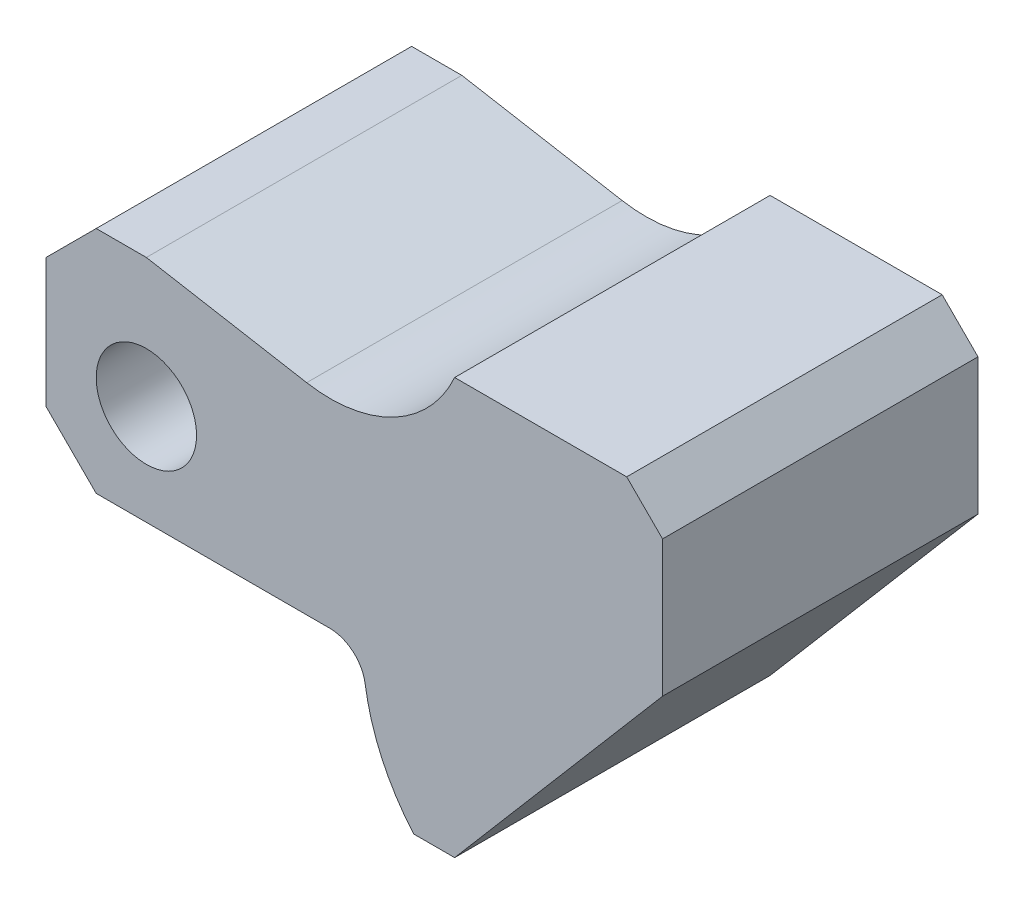
from build123d import *

# Parameters (mm, degrees)
BOSS_EXTRUDE1_DEPTH = 44
SKETCH5_R           = 7
CUT_EXTRUDE1_DEPTH  = 171.828393793
CHAMFER1_SIZE       = 7
CHAMFER2_SIZE       = 7
CHAMFER3_SIZE       = 5


with BuildPart() as part:
    # Sketch4 → Boss-Extrude1 (new body)
    with BuildSketch(Plane.XY):
        with BuildLine():
            Line((-153.475211562, 21.759357812), (-153.475211562, 53.759357812))
            Line((-153.475211562, 53.759357812), (-139.475211562, 53.759357812))
            Line((-139.475211562, 53.759357812), (-117.113830726, 49.816443045))
            ThreePointArc((-117.113830726, 49.816443045), (-104.914112856, 51.741401954), (-96.475211562, 60.759357812))
            Line((-96.475211562, 60.759357812), (-67.475211562, 60.759357812))
            Line((-67.475211562, 60.759357812), (-67.475211562, 36.759357812))
            Line((-67.475211562, 36.759357812), (-96.475211562, 2.759357812))
            Line((-96.475211562, 2.759357812), (-102.178231509, 2.759357812))
            ThreePointArc((-102.178231509, 2.759357812), (-106.617203706, 9.643685751), (-108.954033909, 17.49465193))
            ThreePointArc((-108.954033909, 17.49465193), (-110.63443687, 20.545944044), (-113.899672651, 21.759357812))
            Line((-113.899672651, 21.759357812), (-153.475211562, 21.759357812))
        make_face()
    extrude(amount=BOSS_EXTRUDE1_DEPTH)

    # Sketch5 → Cut-Extrude1 (cut, through all)
    with BuildSketch(Plane.XY):
        with Locations((-139.475211562, 35.759357812)):
            Circle(SKETCH5_R)
    extrude(amount=CUT_EXTRUDE1_DEPTH, mode=Mode.SUBTRACT)

    # Chamfer1
    chamfer1_edges = [part.edges().sort_by_distance(p)[0] for p in [
        (-153.475211562, 53.759357812, 22),
    ]]
    chamfer(chamfer1_edges, length=CHAMFER1_SIZE)

    # Chamfer2
    chamfer2_edges = [part.edges().sort_by_distance(p)[0] for p in [
        (-153.475211562, 21.759357812, 22),
    ]]
    chamfer(chamfer2_edges, length=CHAMFER2_SIZE)

    # Chamfer3
    chamfer3_edges = [part.edges().sort_by_distance(p)[0] for p in [
        (-67.475211562, 60.759357812, 22),
    ]]
    chamfer(chamfer3_edges, length=CHAMFER3_SIZE)


solid = part.part
